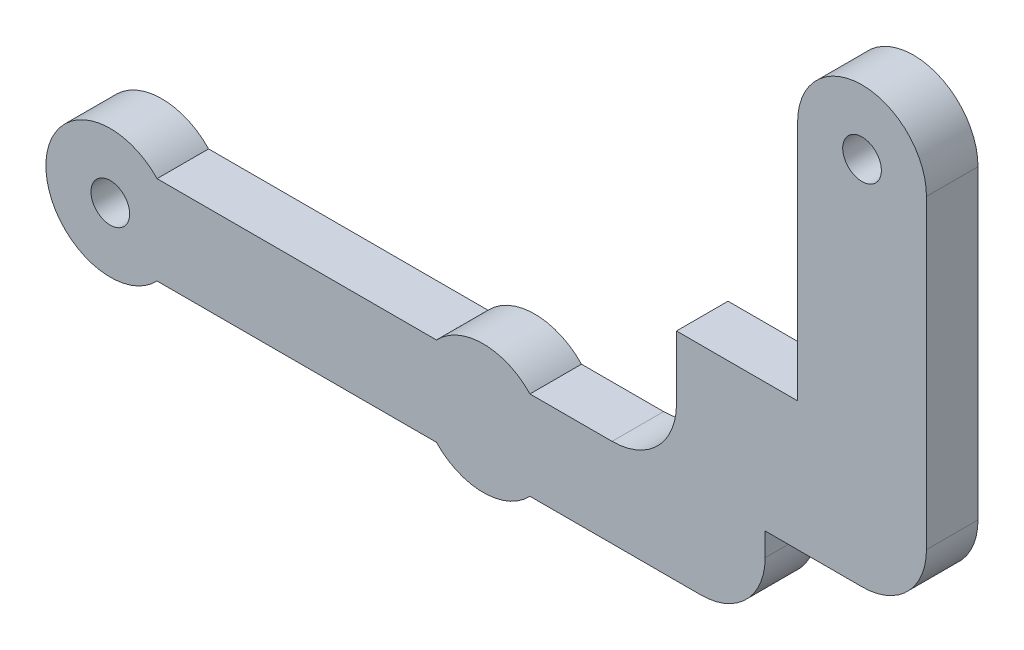
from build123d import *

# Parameters (mm, degrees)
CROQUIS1_R              = 1.5
SALIENTE_EXTRUIR1_DEPTH = 4
SALIENTE_EXTRUIR2_START = -1
CROQUIS2_R              = 1.5
SALIENTE_EXTRUIR2_DEPTH = 1


with BuildPart() as part:
    # Croquis1 → Saliente-Extruir1 (new body)
    with BuildSketch(Plane.XY):
        with BuildLine():
            Line((51.875922813, -14.040123785), (59.395922813, -14.040123785))
            ThreePointArc((59.395922813, -14.040123785), (62.931456719, -12.575657691), (64.395922813, -9.040123785))
            Line((64.395922813, -9.040123785), (64.395922813, 14.699876215))
            ThreePointArc((64.395922813, 14.699876215), (59.395922813, 19.699876215), (54.395922813, 14.699876215))
            Line((54.395922813, 14.699876215), (54.395922813, -4.040123785))
            Line((54.395922813, -4.040123785), (44.995922813, -4.040123785))
            Line((44.995922813, -4.040123785), (44.995922813, -8.960123785))
            ThreePointArc((44.995922813, -8.960123785), (43.531456719, -12.495657691), (39.995922813, -13.960123785))
            Line((39.995922813, -13.960123785), (33.624476244, -13.960123785))
            ThreePointArc((33.624476244, -13.960123785), (29.995922813, -12.400123785), (26.367369382, -13.960123785))
            Line((26.367369382, -13.960123785), (4.684476244, -13.960123785))
            ThreePointArc((4.684476244, -13.960123785), (-3.944077187, -17.400123785), (4.684476244, -20.840123785))
            Line((4.684476244, -20.840123785), (26.367369382, -20.840123785))
            ThreePointArc((26.367369382, -20.840123785), (29.995922813, -22.400123785), (33.624476244, -20.840123785))
            Line((33.624476244, -20.840123785), (46.875922813, -20.840123785))
            ThreePointArc((46.875922813, -20.840123785), (50.411456719, -19.375657691), (51.875922813, -15.840123785))
            Line((51.875922813, -15.840123785), (51.875922813, -14.040123785))
        make_face()
        with Locations((59.395922813, -9.040123785)):
            Circle(CROQUIS1_R, mode=Mode.SUBTRACT)
        with Locations((59.395922813, 1.239876215)):
            Circle(CROQUIS1_R, mode=Mode.SUBTRACT)
        with Locations((59.395922813, 14.699876215)):
            Circle(CROQUIS1_R, mode=Mode.SUBTRACT)
        with Locations((29.995922813, -17.400123785)):
            Circle(CROQUIS1_R, mode=Mode.SUBTRACT)
        with Locations((1.055922813, -17.400123785)):
            Circle(CROQUIS1_R, mode=Mode.SUBTRACT)
    extrude(amount=SALIENTE_EXTRUIR1_DEPTH)

    # Croquis2 → Saliente-Extruir2 (add)
    with BuildSketch(Plane.XY.offset(4).offset(SALIENTE_EXTRUIR2_START)):
        with Locations((59.395922813, 1.239876215)):
            Circle(CROQUIS2_R)
        with Locations((59.395922813, -9.040123785)):
            Circle(CROQUIS2_R)
        with Locations((29.995922813, -17.400123785)):
            Circle(CROQUIS2_R)
    extrude(amount=SALIENTE_EXTRUIR2_DEPTH)


solid = part.part
